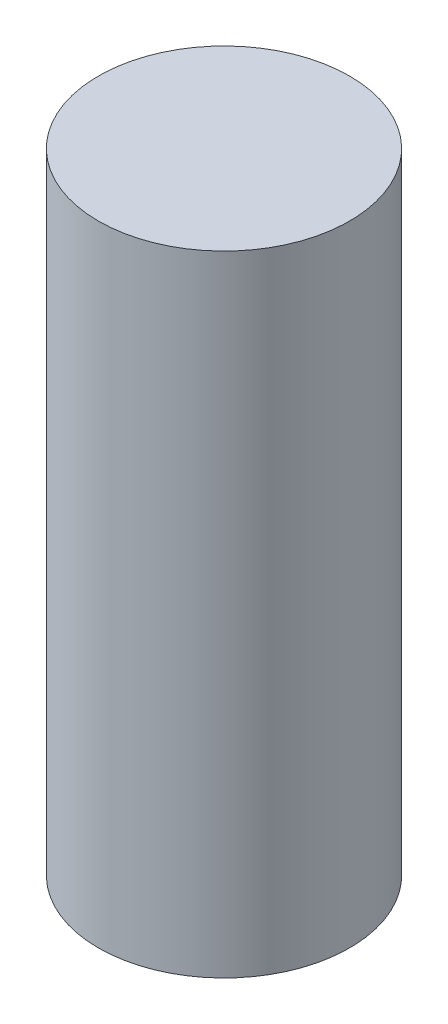
from build123d import *

# Parameters (mm, degrees)
SKETCH1_R           = 13
BOSS_EXTRUDE1_DEPTH = 65.15


with BuildPart() as part:
    # Sketch1 → Boss-Extrude1 (new body)
    with BuildSketch(Plane(origin=(0, 0, 0), x_dir=(1, 0, 0), z_dir=(0, 1, 0))):
        with Locations(Location((0, 0, 0), (0, 0, 270))):
            Circle(SKETCH1_R)
    extrude(amount=BOSS_EXTRUDE1_DEPTH)


solid = part.part
